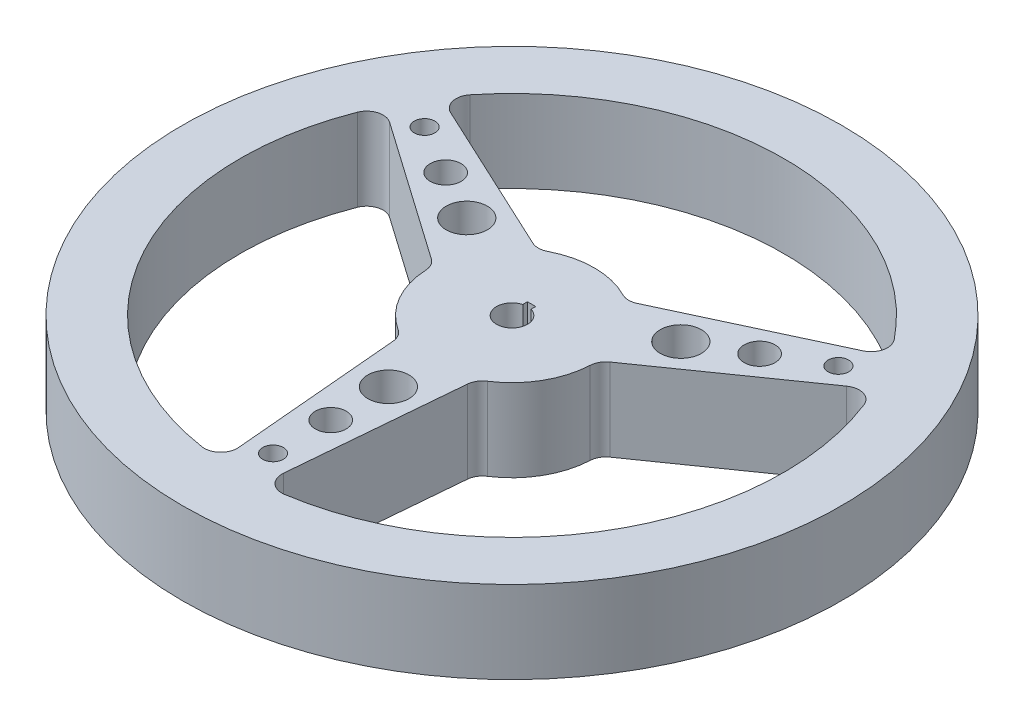
from build123d import *

# Parameters (mm, degrees)
SKETCH1_R           = 50.8
BOSS_EXTRUDE1_DEPTH = 12.7
SKETCH2_R           = 3.175
SKETCH2_R_2         = 2.38125
SKETCH2_R_3         = 1.5875
CUT_EXTRUDE1_DEPTH  = 73.955945611
FILLET1_R           = 2.54


with BuildPart() as part:
    # Sketch1 → Boss-Extrude1 (new body)
    with BuildSketch(Plane(origin=(0, 0, 0), x_dir=(1, 0, 0), z_dir=(0, 1, 0))):
        with Locations(Location((0, 0, 0), (0, 0, 270))):
            Circle(SKETCH1_R)
        with BuildLine():
            Line((-0.635, 2.295022127), (-0.635, 3.01625))
            Line((-0.635, 3.01625), (0.635, 3.01625))
            Line((0.635, 3.01625), (0.635, 2.295022127))
            ThreePointArc((0.635, 2.295022127), (0, -2.38125), (-0.635, 2.295022127))
        make_face(mode=Mode.SUBTRACT)
    extrude(amount=BOSS_EXTRUDE1_DEPTH)

    # Sketch2 → Cut-Extrude1 (cut, through all)
    with BuildSketch(Plane(origin=(0, 12.7, 0), x_dir=(1, 0, 0), z_dir=(0, 1, 0))):
        with BuildLine():
            Line((5.844661521, -11.275190983), (3.175, -41.789561795))
            ThreePointArc((3.175, -41.789561795), (36.295124673, -20.955), (37.778322127, 18.14515024))
            Line((37.778322127, 18.14515024), (12.686932584, 0.575970138))
            ThreePointArc((12.686932584, 0.575970138), (10.998522628, -6.35), (5.844661521, -11.275190983))
        make_face()
        with BuildLine():
            ThreePointArc((-37.778322127, 18.14515024), (-36.295124673, -20.955), (-3.175, -41.789561795))
            Line((-3.175, -41.789561795), (-5.844661521, -11.275190983))
            ThreePointArc((-5.844661521, -11.275190983), (-10.998522628, -6.35), (-12.686932584, 0.575970138))
            Line((-12.686932584, 0.575970138), (-37.778322127, 18.14515024))
        make_face()
        with BuildLine():
            ThreePointArc((34.603322127, 23.644411554), (0, 41.91), (-34.603322127, 23.644411554))
            Line((-34.603322127, 23.644411554), (-6.842271064, 10.699220845))
            ThreePointArc((-6.842271064, 10.699220845), (-3.564400038, 12.189546848), (0, 12.7))
            ThreePointArc((0, 12.7), (3.564400038, 12.189546848), (6.842271064, 10.699220845))
            Line((6.842271064, 10.699220845), (34.603322127, 23.644411554))
        make_face()
        with Locations(Location((0, -19.05, 0), (0, 0, 270))):
            Circle(SKETCH2_R)
        with Locations(Location((0, -27.94, 0), (0, 0, 270))):
            Circle(SKETCH2_R_2)
        with Locations(Location((0, -36.83, 0), (0, 0, 270))):
            Circle(SKETCH2_R_3)
        with Locations(Location((-16.497783942, 9.525, 0), (0, 0, 270))):
            Circle(SKETCH2_R)
        with Locations(Location((-24.196749782, 13.97, 0), (0, 0, 270))):
            Circle(SKETCH2_R_2)
        with Locations(Location((-31.895715621, 18.415, 0), (0, 0, 270))):
            Circle(SKETCH2_R_3)
        with Locations(Location((16.497783942, 9.525, 0), (0, 0, 270))):
            Circle(SKETCH2_R)
        with Locations(Location((24.196749782, 13.97, 0), (0, 0, 270))):
            Circle(SKETCH2_R_2)
        with Locations(Location((31.895715621, 18.415, 0), (0, 0, 270))):
            Circle(SKETCH2_R_3)
    extrude(amount=-CUT_EXTRUDE1_DEPTH, mode=Mode.SUBTRACT)

    # Fillet1
    fillet1_edges = [part.edges().sort_by_distance(p)[0] for p in [
        (-37.778322127, 6.35, -18.14515024),
        (-12.686932584, 6.35, -0.575970138),
        (-5.844661521, 6.35, 11.275190983),
        (-3.175, 6.35, 41.789561795),
        (3.175, 6.35, 41.789561795),
        (5.844661521, 6.35, 11.275190983),
        (12.686932584, 6.35, -0.575970138),
        (37.778322127, 6.35, -18.14515024),
        (-34.603322127, 6.35, -23.644411554),
        (34.603322127, 6.35, -23.644411554),
        (6.842271064, 6.35, -10.699220845),
        (-6.842271064, 6.35, -10.699220845),
    ]]
    fillet(fillet1_edges, radius=FILLET1_R)


solid = part.part
